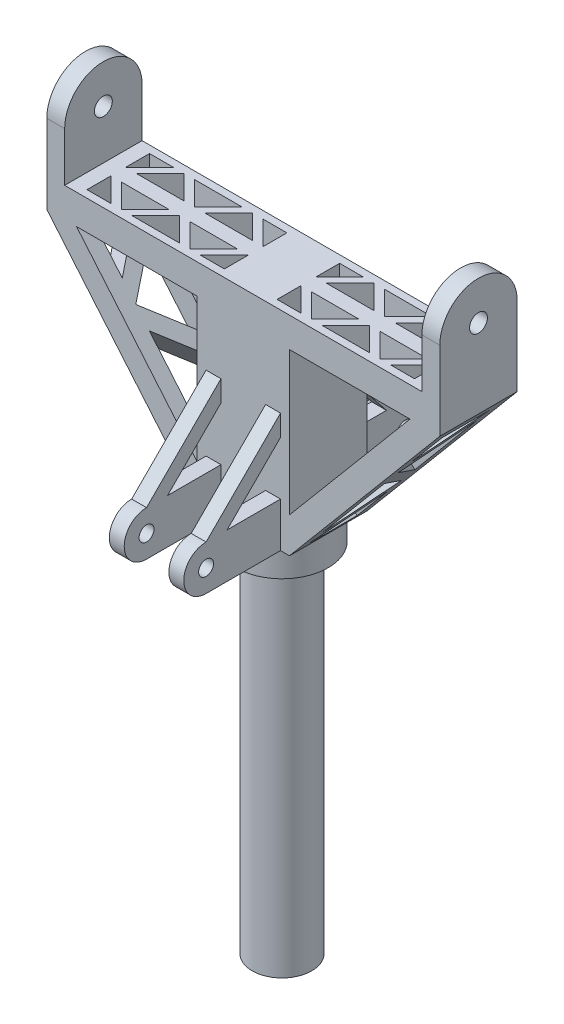
from build123d import *

# Parameters (mm, degrees)
TYKKELSE_LEDDFESTER_OG_BREDDE_H_YDE_SELV_DEPTH = 13
SKETCH28_R                                     = 15.5
SKETCH28_R_2                                   = 10.5
HULL_TIL_L_RBEN_KARBONFIBERR_R_DEPTH           = 10
SKRUEHULL_LEDDFESTER_DEPTH                     = 167.325734629
SKRUEHULL_LEDDFESTER_DEPTH_BACK                = 167.325734629
SKETCH29_R                                     = 3
SKETCH33_W                                     = 5
SKETCH33_H                                     = 20
BREDDE_OG_AVSTAND_STEMPELENDE_DEPTH            = 60
CUT_EXTRUDE4_DEPTH                             = 148.147035308
SIDEM_NSTER_DEPTH                              = 7.650765
SIDEM_NSTER_2_DEPTH                            = 7.650765
UTVIDET_START                                  = -40
SKETCH44_R                                     = 10.5
UTVIDET_L_RBENHULL_INN_I_SELVE_KROPPEN_DEPTH   = 40
M_NSTER_TOPP_DEPTH                             = 10
STEMPELENDE_AV_ST_RSTE_SYLINDER_DEPTH          = 145.150962536
STEMPELENDE_AV_ST_RSTE_SYLINDER_DEPTH_BACK     = 145.150962536
ROD_ENDE_JUSTERE_LENGDEN_ALTS_FESTE_T_R        = 3
SKETCH39_W                                     = 5
SKETCH39_H                                     = 15
SYLINDERFESTE_SELVE_DEN_LILLE_SYLINDERE_DEPTH  = 48
ST_TTER_ST_RSTE_SYLINDER_1_DEPTH               = 5
ST_TTER_ST_RSTE_SYLINDER_2_DEPTH               = 5
SYLINDERFESTE_LITEN_SYLINDER_DEPTH             = 141.653830378
SYLINDERFESTE_LITEN_SYLINDER_DEPTH_BACK        = 141.653830378
SKETCH48_R                                     = 2.5
BOSS_EXTRUDE11_DEPTH                           = 5
BOSS_EXTRUDE12_DEPTH                           = 5
SKETCH51_R                                     = 10
TIL_ASSEMBLY_SLETT_F_R_PRINTING_DEPTH          = 170


with BuildPart() as part:
    # Sketch27 → Tykkelse leddfester og bredde/høyde selve modellen (new, symmetric)
    with BuildSketch(Plane.XY):
        Polygon((66, 0), (-66, 0), (-66, 100), (-60, 100), (-60, 70), (60, 70), (60, 100), (66, 100), align=None)
    extrude(amount=TYKKELSE_LEDDFESTER_OG_BREDDE_H_YDE_SELV_DEPTH, both=True)

    # Sketch28 → Hull til lårben/karbonfiberrør (add)
    with BuildSketch(Plane.XZ):
        with Locations(Location((0, 0, 0), (0, 0, 57.004114526))):
            Circle(SKETCH28_R)
        with Locations(Location((0, 0, 0), (0, 0, 270))):
            Circle(SKETCH28_R_2, mode=Mode.SUBTRACT)
    extrude(amount=HULL_TIL_L_RBEN_KARBONFIBERR_R_DEPTH)

    # Sketch29 → Skruehull leddfester (cut, two sides: drawn at the far end of the back side and taken through both)
    with BuildSketch(Plane(origin=(66, 0, 0), x_dir=(0, 0, -1), z_dir=(1, 0, 0)).offset(-SKRUEHULL_LEDDFESTER_DEPTH_BACK)):
        with Locations((0, 86.5)):
            Circle(SKETCH29_R)
        with BuildLine():
            Line((-13, 86.5), (-13, 71.5))
            Line((-13, 71.5), (-14, 71.5))
            Line((-14, 71.5), (-14, 101))
            Line((-14, 101), (0, 101))
            Line((0, 101), (14, 101))
            Line((14, 101), (14, 71.5))
            Line((14, 71.5), (13, 71.5))
            Line((13, 71.5), (13, 86.5))
            ThreePointArc((13, 86.5), (0, 99.5), (-13, 86.5))
        make_face()
    extrude(amount=SKRUEHULL_LEDDFESTER_DEPTH + SKRUEHULL_LEDDFESTER_DEPTH_BACK, mode=Mode.SUBTRACT)

    # Sketch33 → Bredde og avstand stempelende (add)
    with BuildSketch(Plane(origin=(0, 0, -13), x_dir=(-1, 0, 0), z_dir=(0, 0, -1))):
        with Locations((-6, 10)):
            Rectangle(SKETCH33_W, SKETCH33_H)
        with Locations((6, 10)):
            Rectangle(SKETCH33_W, SKETCH33_H)
    extrude(amount=BREDDE_OG_AVSTAND_STEMPELENDE_DEPTH)

    # Fasong (mønster på selve kroppen) → Cut-Extrude4 (cut, through all)
    with BuildSketch(Plane.XY.offset(13)):
        Polygon((-66, 60), (-15.5, 0), (-66, 0), align=None)
        Polygon((15.5, 0), (66, 0), (66, 60), align=None)
        Polygon((-56, 60), (-15.5, 11.881188119), (-15.5, 60), align=None)
        Polygon((56, 60), (15.5, 60), (15.5, 11.881188119), align=None)
    extrude(amount=-CUT_EXTRUDE4_DEPTH, mode=Mode.SUBTRACT)

    # Sketch40 → Sidemønster (cut)
    with BuildSketch(Plane(origin=(-9.072801919, -7.636274948, 0), x_dir=(0, 0, 1), z_dir=(-0.765076505498557, -0.6439393921279521, 0))):
        Polygon((-8, 81.90459021), (8, 81.90459021), (8, 65.90459021), align=None)
        Polygon((-8, 74.833522398), (8, 58.833522398), (-8, 42.833522398), align=None)
        Polygon((8, 19.762454587), (-8, 35.762454587), (8, 51.762454587), align=None)
        Polygon((-8, 28.691386775), (8, 12.691386775), (-8, 12.691386775), align=None)
    extrude(amount=-SIDEM_NSTER_DEPTH, mode=Mode.SUBTRACT)

    # Sketch42 → Sidemønster 2 (cut)
    with BuildSketch(Plane(origin=(9.072801919, -7.636274948, 0), x_dir=(0, 0, -1), z_dir=(0.765076505498557, -0.6439393921279521, 0))):
        Polygon((8, 81.90459021), (-8, 81.90459021), (-8, 65.90459021), align=None)
        Polygon((8, 74.833522398), (-8, 58.833522398), (8, 42.833522398), align=None)
        Polygon((-8, 51.762454587), (8, 35.762454587), (-8, 19.762454587), align=None)
        Polygon((8, 28.691386775), (-8, 12.691386775), (8, 12.691386775), align=None)
    extrude(amount=-SIDEM_NSTER_2_DEPTH, mode=Mode.SUBTRACT)

    # Sketch44 → Utvidet lårbenhull inn i selve kroppen (cut)
    with BuildSketch(Plane.XZ.offset(UTVIDET_START)):
        with Locations(Location((0, 0, 0), (0, 0, 270))):
            Circle(SKETCH44_R)
    extrude(amount=UTVIDET_L_RBENHULL_INN_I_SELVE_KROPPEN_DEPTH, mode=Mode.SUBTRACT)

    # Sketch45 → Mønster topp (cut)
    with BuildSketch(Plane(origin=(0, 70, 0), x_dir=(1, 0, 0), z_dir=(0, 1, 0))):
        Polygon((-39.928932188, 10.5), (-31.928932188, 2.5), (-23.928932188, 10.5), align=None)
        Polygon((-16.857864376, 10.5), (-8.857864376, 2.5), (-8.857864376, 10.5), align=None)
        Polygon((-55, 2.5), (-55, 10.5), (-47, 10.5), align=None)
        Polygon((-43.464466094, 10.5), (-51.464466094, 2.5), (-35.464466094, 2.5), align=None)
        Polygon((-20.393398282, 10.5), (-28.393398282, 2.5), (-12.393398282, 2.5), align=None)
        Polygon((-8.857864376, -2.5), (-8.857864376, -10.5), (-16.857864376, -10.5), align=None)
        Polygon((-20.393398282, -10.5), (-12.393398282, -2.5), (-28.393398282, -2.5), align=None)
        Polygon((-23.928932188, -10.5), (-31.928932188, -2.5), (-39.928932188, -10.5), align=None)
        Polygon((-43.464466094, -10.5), (-35.464466094, -2.5), (-51.464466094, -2.5), align=None)
        Polygon((-55, -10.5), (-47, -10.5), (-55, -2.5), align=None)
        Polygon((8.857864376, 2.5), (8.857864376, 10.5), (16.857864376, 10.5), align=None)
        Polygon((16.857864376, -10.5), (8.857864376, -2.5), (8.857864376, -10.5), align=None)
        Polygon((20.393398282, -10.5), (28.393398282, -2.5), (12.393398282, -2.5), align=None)
        Polygon((20.393398282, 10.5), (12.393398282, 2.5), (28.393398282, 2.5), align=None)
        Polygon((23.928932188, 10.5), (31.928932188, 2.5), (39.928932188, 10.5), align=None)
        Polygon((23.928932188, -10.5), (39.928932188, -10.5), (31.928932188, -2.5), align=None)
        Polygon((43.464466094, -10.5), (51.464466094, -2.5), (35.464466094, -2.5), align=None)
        Polygon((55, -2.5), (55, -10.5), (47, -10.5), align=None)
        Polygon((43.464466094, 10.5), (35.464466094, 2.5), (51.464466094, 2.5), align=None)
        Polygon((55, 10.5), (47, 10.5), (55, 2.5), align=None)
    extrude(amount=-M_NSTER_TOPP_DEPTH, mode=Mode.SUBTRACT)

    # Rod-ende, justere lengden (altså feste til største sylinder) → Stempelende av st_rste sylinder (cut, two sides: drawn at the far end of the back side and taken through both)
    with BuildSketch(Plane(origin=(8.5, 0, 0), x_dir=(0, 0, -1), z_dir=(1, 0, 0)).offset(-STEMPELENDE_AV_ST_RSTE_SYLINDER_DEPTH_BACK)):
        with Locations((33, 10)):
            Circle(ROD_ENDE_JUSTERE_LENGDEN_ALTS_FESTE_T_R)
        with BuildLine():
            Line((43, -1), (74, -1))
            Line((74, -1), (74, 21))
            Line((74, 21), (43, 21))
            Line((43, 21), (13, 21))
            Line((13, 21), (13, 19))
            Line((13, 19), (33, 19))
            ThreePointArc((33, 19), (42, 10), (33, 1))
            Line((33, 1), (13, 1))
            Line((13, 1), (13, -1))
            Line((13, -1), (43, -1))
        make_face()
    extrude(amount=STEMPELENDE_AV_ST_RSTE_SYLINDER_DEPTH + STEMPELENDE_AV_ST_RSTE_SYLINDER_DEPTH_BACK, mode=Mode.SUBTRACT)

    # Sketch39 → Sylinderfeste_ selve den lille sylindere (add)
    with BuildSketch(Plane.XY.offset(13)):
        with Locations((-10, 7.5)):
            Rectangle(SKETCH39_W, SKETCH39_H)
        with Locations((10, 7.5)):
            Rectangle(SKETCH39_W, SKETCH39_H)
    extrude(amount=SYLINDERFESTE_SELVE_DEN_LILLE_SYLINDERE_DEPTH)

    # Sketch46 → Støtter største sylinder 1 (add)
    with BuildSketch(Plane(origin=(8.5, 0, 0), x_dir=(0, 0, -1), z_dir=(1, 0, 0))):
        Polygon((13, 44), (13, 35.996094703), (26.596875763, 19), (33, 19), align=None)
    extrude(amount=-ST_TTER_ST_RSTE_SYLINDER_1_DEPTH)

    # Sketch47 → Støtter største sylinder 2 (add)
    with BuildSketch(Plane.ZY.offset(8.5)):
        Polygon((-33, 19), (-13, 44), (-13, 35.996094703), (-26.596875763, 19), align=None)
    extrude(amount=-ST_TTER_ST_RSTE_SYLINDER_2_DEPTH)

    # Sketch48 → Sylinderfeste, liten sylinder (cut, two sides: drawn at the far end of the back side and taken through both)
    with BuildSketch(Plane.ZY.offset(12.5).offset(-SYLINDERFESTE_LITEN_SYLINDER_DEPTH_BACK)):
        with Locations(Location((38, 7.5, 0), (0, 0, 270))):
            Circle(SKETCH48_R)
        with BuildLine():
            Line((38, 0), (23.179811187, 0))
            Line((23.179811187, 0), (23.179811187, -1))
            Line((23.179811187, -1), (62, -1))
            Line((62, -1), (62, 16))
            Line((62, 16), (13, 16))
            Line((13, 16), (13, 15))
            Line((13, 15), (38, 15))
            ThreePointArc((38, 15), (45.5, 7.5), (38, 0))
        make_face()
    extrude(amount=SYLINDERFESTE_LITEN_SYLINDER_DEPTH + SYLINDERFESTE_LITEN_SYLINDER_DEPTH_BACK, mode=Mode.SUBTRACT)

    # Sketch49 → Boss-Extrude11 (add)
    with BuildSketch(Plane.ZY.offset(12.5)):
        Polygon((38, 15), (13, 40), (13, 32.928932188), (30.928932188, 15), align=None)
    extrude(amount=-BOSS_EXTRUDE11_DEPTH)

    # Sketch50 → Boss-Extrude12 (add)
    with BuildSketch(Plane(origin=(12.5, 0, 0), x_dir=(0, 0, -1), z_dir=(1, 0, 0))):
        Polygon((-38, 15), (-30.928932188, 15), (-13, 32.928932188), (-13, 40), align=None)
    extrude(amount=-BOSS_EXTRUDE12_DEPTH)

    # Sketch51 → TIL ASSEMBLY - SLETT FØR PRINTING (add)
    with BuildSketch(Plane.XZ.offset(-40)):
        with Locations(Location((0, 0, 0), (0, 0, 270))):
            Circle(SKETCH51_R)
    extrude(amount=TIL_ASSEMBLY_SLETT_F_R_PRINTING_DEPTH)


solid = part.part
